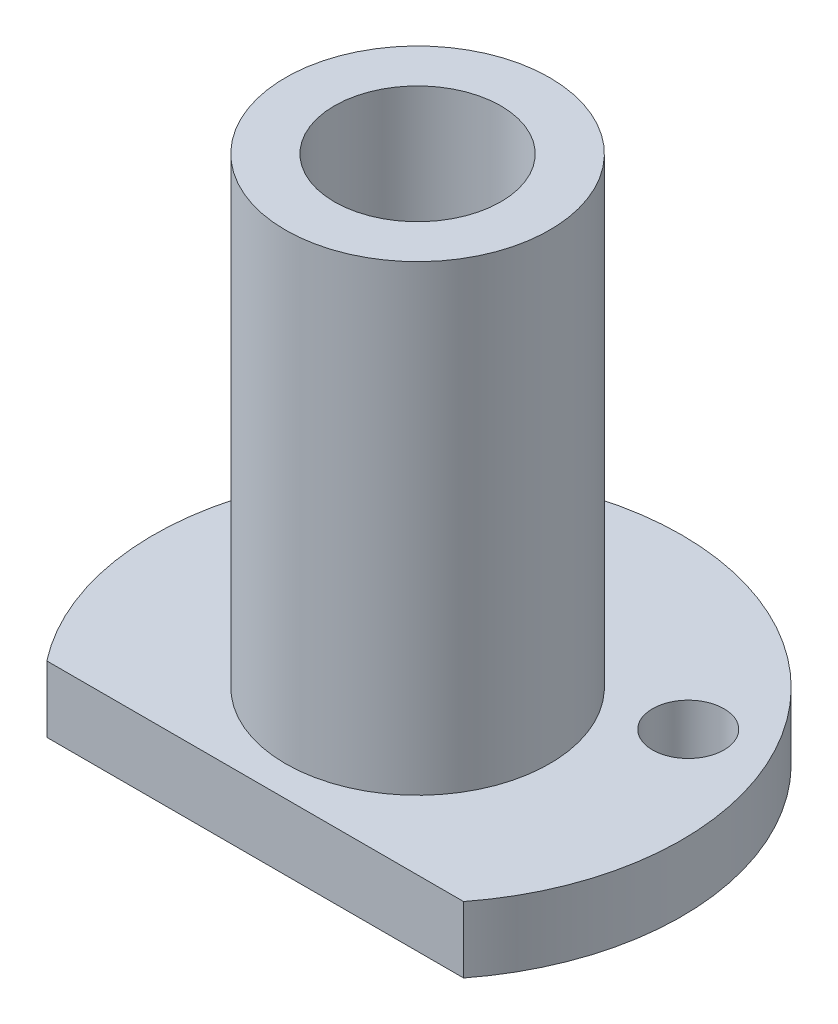
from build123d import *

# Parameters (mm, degrees)
SKETCH1_R           = 19.05
BOSS_EXTRUDE1_DEPTH = 4.7752
SKETCH2_R           = 9.525
BOSS_EXTRUDE2_DEPTH = 33.3248
CUT_EXTRUDE1_REACH  = 48.663
SKETCH3_R           = 2.5781
CUT_EXTRUDE2_REACH  = 48.663
SKETCH4_R           = 6
CUT_EXTRUDE3_REACH  = 48.663


with BuildPart() as part:
    # Sketch1 → Boss-Extrude1 (new body)
    with BuildSketch(Plane(origin=(0, 0, 0), x_dir=(1, 0, 0), z_dir=(0, 1, 0))):
        with Locations(Location((0, 0, 0), (0, 0, 270))):
            Circle(SKETCH1_R)
    extrude(amount=BOSS_EXTRUDE1_DEPTH)

    # Sketch2 → Boss-Extrude2 (add)
    with BuildSketch(Plane(origin=(0, 4.7752, 0), x_dir=(1, 0, 0), z_dir=(0, 1, 0))):
        with Locations(Location((0, 0, 0), (0, 0, 270))):
            Circle(SKETCH2_R)
    extrude(amount=BOSS_EXTRUDE2_DEPTH)

    # Sketch3 → Cut-Extrude1 (cut, up to next)
    with BuildSketch(Plane.XZ, mode=Mode.PRIVATE) as cut_extrude1_sk1:
        with Locations(Location((0, 14.2875, 0), (0, 0, 270))):
            Circle(SKETCH3_R)
    cut_extrude1_tool1 = extrude(cut_extrude1_sk1.sketch, amount=-CUT_EXTRUDE1_REACH, mode=Mode.PRIVATE) & part.part
    # Sketch3 → Cut-Extrude1 (cut, up to next)
    with BuildSketch(Plane.XZ, mode=Mode.PRIVATE) as cut_extrude1_sk2:
        with Locations(Location((-12.373337957, -7.14375, 0), (0, 0, 270))):
            Circle(SKETCH3_R)
    cut_extrude1_tool2 = extrude(cut_extrude1_sk2.sketch, amount=-CUT_EXTRUDE1_REACH, mode=Mode.PRIVATE) & part.part
    # Sketch3 → Cut-Extrude1 (cut, up to next)
    with BuildSketch(Plane.XZ, mode=Mode.PRIVATE) as cut_extrude1_sk3:
        with Locations(Location((12.373337957, -7.14375, 0), (0, 0, 270))):
            Circle(SKETCH3_R)
    cut_extrude1_tool3 = extrude(cut_extrude1_sk3.sketch, amount=-CUT_EXTRUDE1_REACH, mode=Mode.PRIVATE) & part.part
    add(cut_extrude1_tool1.solids().sort_by_distance((0, 0, 14.2875))[0], mode=Mode.SUBTRACT)
    add(cut_extrude1_tool2.solids().sort_by_distance((-12.373338, 0, -7.14375))[0], mode=Mode.SUBTRACT)
    add(cut_extrude1_tool3.solids().sort_by_distance((12.373338, 0, -7.14375))[0], mode=Mode.SUBTRACT)

    # Sketch4 → Cut-Extrude2 (cut, up to next)
    with BuildSketch(Plane.XZ, mode=Mode.PRIVATE) as cut_extrude2_sk1:
        with Locations(Location((0, 0, 0), (0, 0, 270))):
            Circle(SKETCH4_R)
    cut_extrude2_tool1 = extrude(cut_extrude2_sk1.sketch, amount=-CUT_EXTRUDE2_REACH, mode=Mode.PRIVATE) & part.part
    add(cut_extrude2_tool1.solids().sort_by_distance((0, 0, 0))[0], mode=Mode.SUBTRACT)

    # Sketch5 → Cut-Extrude3 (cut, up to next)
    with BuildSketch(Plane(origin=(0, 0, 0), x_dir=(-1, 0, 0), z_dir=(0, -1, 0)), mode=Mode.PRIVATE) as cut_extrude3_sk1:
        with BuildLine():
            Line((15.026391837, -11.7094), (-15.026391837, -11.7094))
            ThreePointArc((-15.026391837, -11.7094), (0, -19.05), (15.026391837, -11.7094))
        make_face()
    cut_extrude3_tool1 = extrude(cut_extrude3_sk1.sketch, amount=-CUT_EXTRUDE3_REACH, mode=Mode.PRIVATE) & part.part
    add(cut_extrude3_tool1.solids().sort_by_distance((0, 0, 14.700269))[0], mode=Mode.SUBTRACT)


solid = part.part
